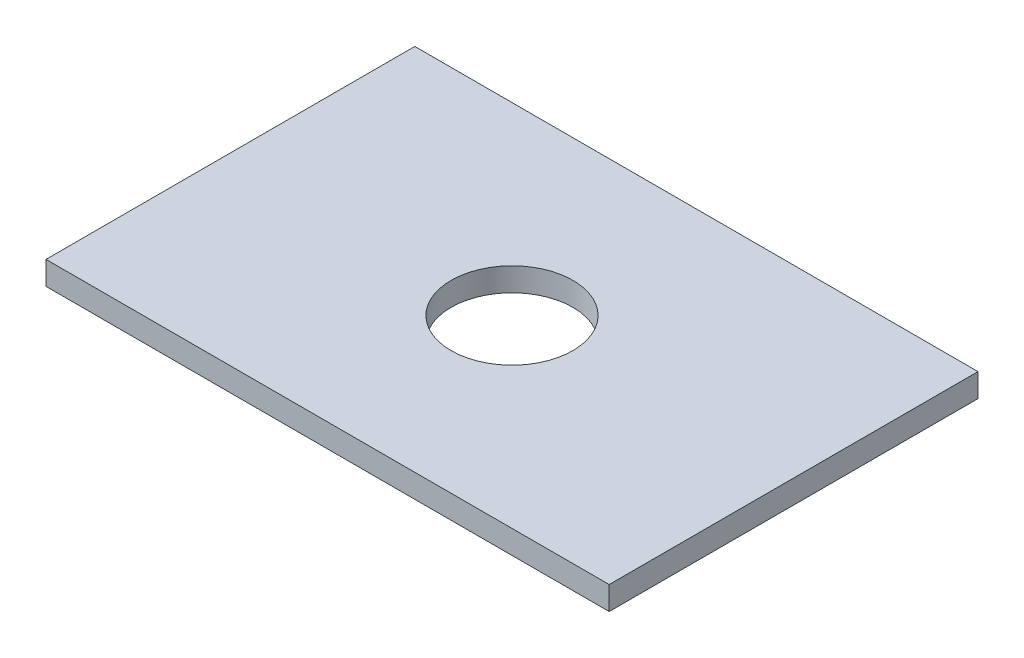
from build123d import *

# Parameters (mm, degrees)
SKETCH1_W           = 152.7
SKETCH1_H           = 100
BOSS_EXTRUDE1_DEPTH = 6.35
SKETCH2_R           = 16.51
CUT_EXTRUDE1_DEPTH  = 10


with BuildPart() as part:
    # Sketch1 → Boss-Extrude1 (new body)
    with BuildSketch(Plane(origin=(0, 0, 0), x_dir=(1, 0, 0), z_dir=(0, 1, 0))):
        with Locations((76.35, 50)):
            Rectangle(SKETCH1_W, SKETCH1_H)
    extrude(amount=BOSS_EXTRUDE1_DEPTH)

    # Sketch2 → Cut-Extrude1 (cut)
    with BuildSketch(Plane(origin=(0, 6.35, 0), x_dir=(1, 0, 0), z_dir=(0, 1, 0))):
        with Locations(Location((76.35, 50, 0), (0, 0, 270))):
            Circle(SKETCH2_R)
    extrude(amount=-CUT_EXTRUDE1_DEPTH, mode=Mode.SUBTRACT)


solid = part.part
